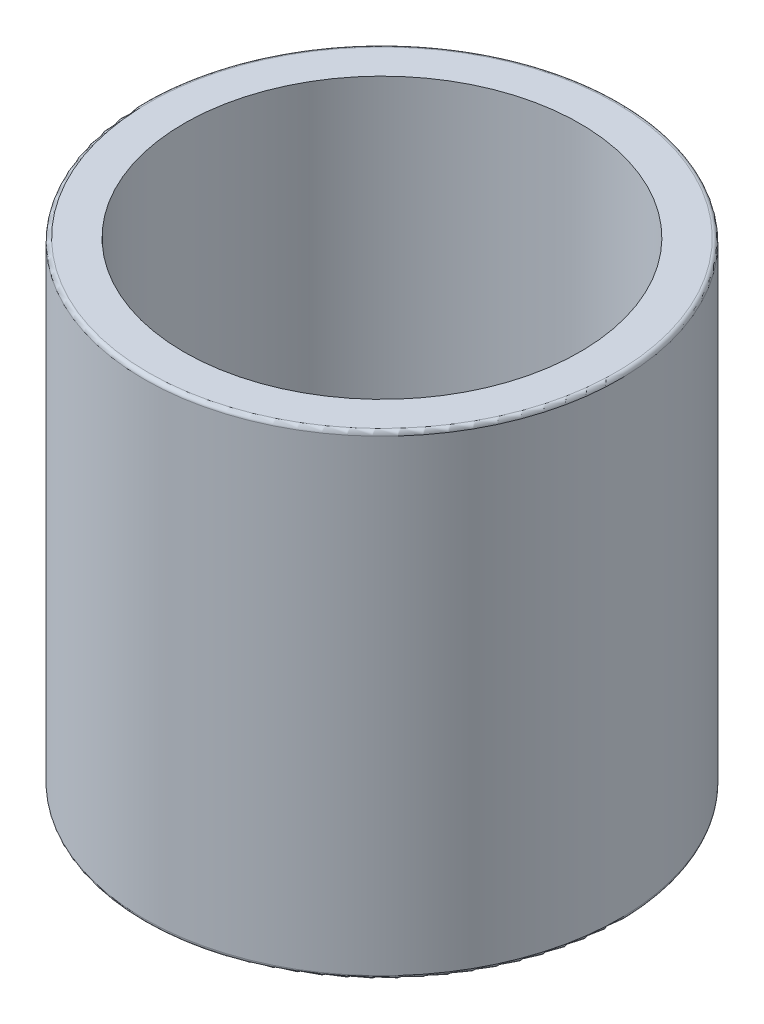
from build123d import *

# Parameters (mm, degrees)
SKIZZE1_R                       = 6
SKIZZE1_R_2                     = 5
AUFSATZ_LINEAR_AUSTRAGEN1_DEPTH = 6
VERRUNDUNG1_R                   = 0.1


with BuildPart() as part:
    # Skizze1 → Aufsatz-Linear austragen1 (new, symmetric)
    with BuildSketch(Plane(origin=(0, 0, 0), x_dir=(1, 0, 0), z_dir=(0, 1, 0))):
        with Locations(Location((0, 0, 0), (0, 0, 270))):
            Circle(SKIZZE1_R)
        with Locations(Location((0, 0, 0), (0, 0, 270))):
            Circle(SKIZZE1_R_2, mode=Mode.SUBTRACT)
    extrude(amount=AUFSATZ_LINEAR_AUSTRAGEN1_DEPTH, both=True)

    # Verrundung1
    verrundung1_edges = [part.edges().sort_by_distance(p)[0] for p in [
        (0, -6, -6),
        (0, 6, -6),
    ]]
    fillet(verrundung1_edges, radius=VERRUNDUNG1_R)


solid = part.part
